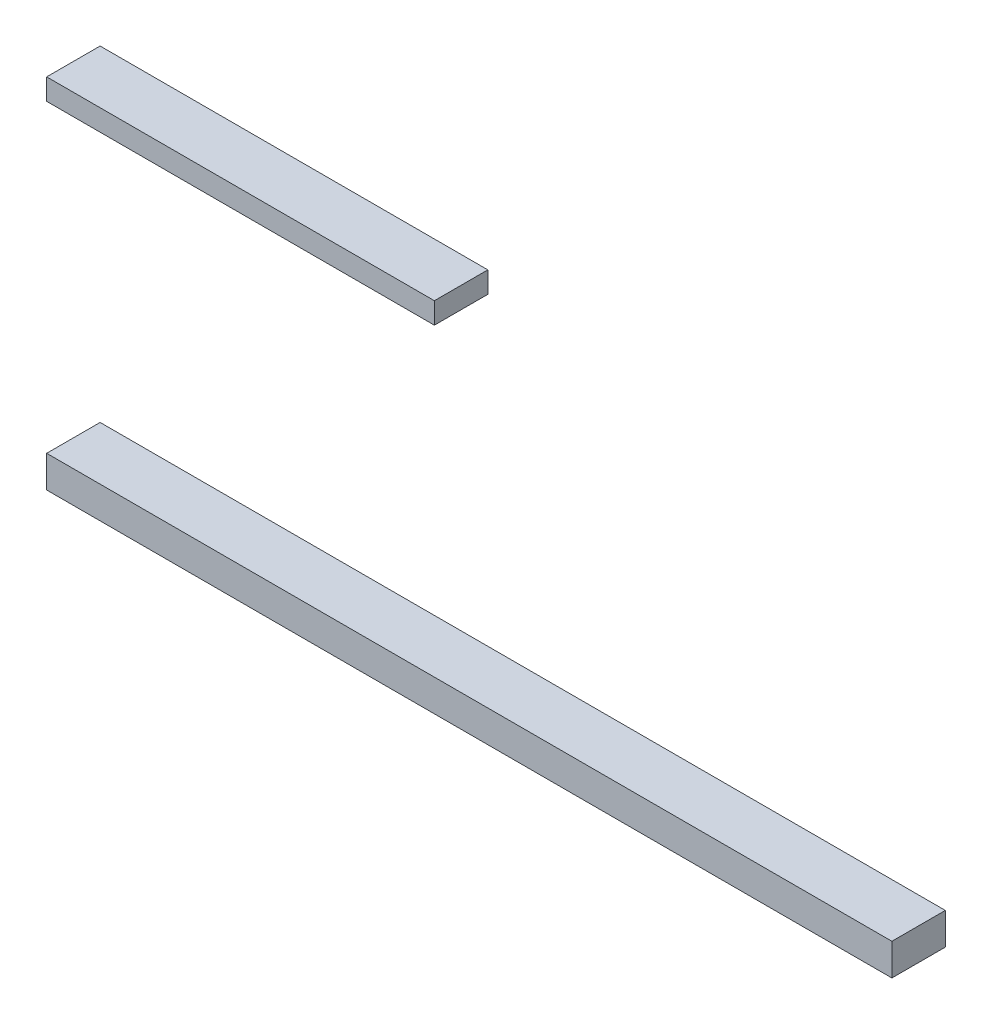
from build123d import *

# Parameters (mm, degrees)
SKETCH_1_W        = 3985
SKETCH_1_H        = 150
EXTRUDE_1_DEPTH   = 252
SKETCH_1_W_2      = 1828
SKETCH_1_H_2      = 100
EXTRUDE_1_2_DEPTH = 252


with BuildPart() as part:
    # Эскиз1 → Бобышка-Вытянуть1 (new body)
    with BuildSketch(Plane.XY):
        with Locations((5191.5, -3318)):
            Rectangle(SKETCH_1_W, SKETCH_1_H)
    extrude(amount=EXTRUDE_1_DEPTH)


with BuildPart() as body_2:
    # Эскиз1 → Extrude 1 2 (new body)
    with BuildSketch(Plane.XY):
        with Locations((4113, -1756)):
            Rectangle(SKETCH_1_W_2, SKETCH_1_H_2)
    extrude(amount=EXTRUDE_1_2_DEPTH)


solid = Compound([part.part, body_2.part])
